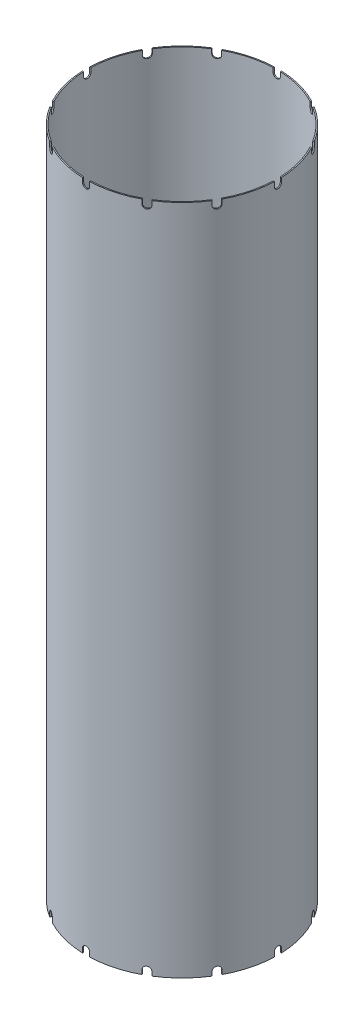
from build123d import *

# Parameters (mm, degrees)
SKETCH1_R             = 84.455
SKETCH1_R_2           = 83.439
BOSS_EXTRUDE1_DEPTH   = 591.201764
CUT_EXTRUDE1_DEPTH    = 604.145769948
CIRPATTERN1_COUNT     = 12
MIRROR1_COPY_1_DEPTH  = 604.145769948
MIRROR1_COPY_2_DEPTH  = 604.145769948
MIRROR1_COPY_3_DEPTH  = 604.145769948
MIRROR1_COPY_4_DEPTH  = 604.145769948
MIRROR1_COPY_5_DEPTH  = 604.145769948
MIRROR1_COPY_6_DEPTH  = 604.145769948
MIRROR1_COPY_7_DEPTH  = 604.145769948
MIRROR1_COPY_8_DEPTH  = 604.145769948
MIRROR1_COPY_9_DEPTH  = 604.145769948
MIRROR1_COPY_10_DEPTH = 604.145769948
MIRROR1_COPY_11_DEPTH = 604.145769948


with BuildPart() as part:
    # Sketch1 → Boss-Extrude1 (new body)
    with BuildSketch(Plane(origin=(0, 0, 0), x_dir=(1, 0, 0), z_dir=(0, 1, 0))):
        with Locations(Location((0, 0, 0), (0, 0, 270))):
            Circle(SKETCH1_R)
        with Locations(Location((0, 0, 0), (0, 0, 270))):
            Circle(SKETCH1_R_2, mode=Mode.SUBTRACT)
    extrude(amount=BOSS_EXTRUDE1_DEPTH)

    # Sketch2 → Cut-Extrude1 (cut, through all)
    with BuildSketch(Plane.XY):
        with BuildLine():
            Line((3.175, 3.81), (3.175, -68.02879514))
            ThreePointArc((3.175, -68.02879514), (0, -71.20379514), (-3.175, -68.02879514))
            Line((-3.175, -68.02879514), (-3.175, 3.81))
            ThreePointArc((-3.175, 3.81), (0, 6.985), (3.175, 3.81))
        make_face()
    cut_extrude1 = extrude(amount=-CUT_EXTRUDE1_DEPTH, mode=Mode.SUBTRACT)

    # CirPattern1: Cut-Extrude1 ×12 about axis
    cirpattern1_axis = Axis((0, 0, 0), (0, 1, 0))
    for i in range(1, CIRPATTERN1_COUNT):
        add(cut_extrude1.rotate(cirpattern1_axis, i * 360 / CIRPATTERN1_COUNT), mode=Mode.SUBTRACT)

    # Mirror1: Cut-Extrude1 across plane
    add(cut_extrude1.mirror(Plane.ZX.offset(295.600882)), mode=Mode.SUBTRACT)

    # Mirror1 copy 1 sketch → Mirror1 copy 1 (cut, through all)
    with BuildSketch(Plane(origin=(0, 591.201764, 0), x_dir=(0.8660254037844387, 0, -0.49999999999999994), z_dir=(0.49999999999999994, 0, 0.8660254037844387))):
        with BuildLine():
            Line((3.175, -3.81), (3.175, 68.02879514))
            ThreePointArc((3.175, 68.02879514), (0, 71.20379514), (-3.175, 68.02879514))
            Line((-3.175, 68.02879514), (-3.175, -3.81))
            ThreePointArc((-3.175, -3.81), (0, -6.985), (3.175, -3.81))
        make_face()
    extrude(amount=-MIRROR1_COPY_1_DEPTH, mode=Mode.SUBTRACT)

    # Mirror1 copy 2 sketch → Mirror1 copy 2 (cut, through all)
    with BuildSketch(Plane(origin=(0, 591.201764, 0), x_dir=(0.5000000000000001, 0, -0.8660254037844386), z_dir=(0.8660254037844386, 0, 0.5000000000000001))):
        with BuildLine():
            Line((3.175, -3.81), (3.175, 68.02879514))
            ThreePointArc((3.175, 68.02879514), (0, 71.20379514), (-3.175, 68.02879514))
            Line((-3.175, 68.02879514), (-3.175, -3.81))
            ThreePointArc((-3.175, -3.81), (0, -6.985), (3.175, -3.81))
        make_face()
    extrude(amount=-MIRROR1_COPY_2_DEPTH, mode=Mode.SUBTRACT)

    # Mirror1 copy 3 sketch → Mirror1 copy 3 (cut, through all)
    with BuildSketch(Plane(origin=(0, 591.201764, 0), x_dir=(0, 0, -1), z_dir=(1, 0, 0))):
        with BuildLine():
            Line((3.175, -3.81), (3.175, 68.02879514))
            ThreePointArc((3.175, 68.02879514), (0, 71.20379514), (-3.175, 68.02879514))
            Line((-3.175, 68.02879514), (-3.175, -3.81))
            ThreePointArc((-3.175, -3.81), (0, -6.985), (3.175, -3.81))
        make_face()
    extrude(amount=-MIRROR1_COPY_3_DEPTH, mode=Mode.SUBTRACT)

    # Mirror1 copy 4 sketch → Mirror1 copy 4 (cut, through all)
    with BuildSketch(Plane(origin=(0, 591.201764, 0), x_dir=(-0.4999999999999998, 0, -0.8660254037844387), z_dir=(0.8660254037844387, 0, -0.4999999999999998))):
        with BuildLine():
            Line((3.175, -3.81), (3.175, 68.02879514))
            ThreePointArc((3.175, 68.02879514), (0, 71.20379514), (-3.175, 68.02879514))
            Line((-3.175, 68.02879514), (-3.175, -3.81))
            ThreePointArc((-3.175, -3.81), (0, -6.985), (3.175, -3.81))
        make_face()
    extrude(amount=-MIRROR1_COPY_4_DEPTH, mode=Mode.SUBTRACT)

    # Mirror1 copy 5 sketch → Mirror1 copy 5 (cut, through all)
    with BuildSketch(Plane(origin=(0, 591.201764, 0), x_dir=(-0.8660254037844387, 0, -0.49999999999999994), z_dir=(0.49999999999999994, 0, -0.8660254037844387))):
        with BuildLine():
            Line((3.175, -3.81), (3.175, 68.02879514))
            ThreePointArc((3.175, 68.02879514), (0, 71.20379514), (-3.175, 68.02879514))
            Line((-3.175, 68.02879514), (-3.175, -3.81))
            ThreePointArc((-3.175, -3.81), (0, -6.985), (3.175, -3.81))
        make_face()
    extrude(amount=-MIRROR1_COPY_5_DEPTH, mode=Mode.SUBTRACT)

    # Mirror1 copy 6 sketch → Mirror1 copy 6 (cut, through all)
    with BuildSketch(Plane(origin=(0, 591.201764, 0), x_dir=(-1, 0, 0), z_dir=(0, 0, -1))):
        with BuildLine():
            Line((3.175, -3.81), (3.175, 68.02879514))
            ThreePointArc((3.175, 68.02879514), (0, 71.20379514), (-3.175, 68.02879514))
            Line((-3.175, 68.02879514), (-3.175, -3.81))
            ThreePointArc((-3.175, -3.81), (0, -6.985), (3.175, -3.81))
        make_face()
    extrude(amount=-MIRROR1_COPY_6_DEPTH, mode=Mode.SUBTRACT)

    # Mirror1 copy 7 sketch → Mirror1 copy 7 (cut, through all)
    with BuildSketch(Plane(origin=(0, 591.201764, 0), x_dir=(-0.8660254037844386, 0, 0.5000000000000001), z_dir=(-0.5000000000000001, 0, -0.8660254037844386))):
        with BuildLine():
            Line((3.175, -3.81), (3.175, 68.02879514))
            ThreePointArc((3.175, 68.02879514), (0, 71.20379514), (-3.175, 68.02879514))
            Line((-3.175, 68.02879514), (-3.175, -3.81))
            ThreePointArc((-3.175, -3.81), (0, -6.985), (3.175, -3.81))
        make_face()
    extrude(amount=-MIRROR1_COPY_7_DEPTH, mode=Mode.SUBTRACT)

    # Mirror1 copy 8 sketch → Mirror1 copy 8 (cut, through all)
    with BuildSketch(Plane(origin=(0, 591.201764, 0), x_dir=(-0.5000000000000004, 0, 0.8660254037844384), z_dir=(-0.8660254037844384, 0, -0.5000000000000004))):
        with BuildLine():
            Line((3.175, -3.81), (3.175, 68.02879514))
            ThreePointArc((3.175, 68.02879514), (0, 71.20379514), (-3.175, 68.02879514))
            Line((-3.175, 68.02879514), (-3.175, -3.81))
            ThreePointArc((-3.175, -3.81), (0, -6.985), (3.175, -3.81))
        make_face()
    extrude(amount=-MIRROR1_COPY_8_DEPTH, mode=Mode.SUBTRACT)

    # Mirror1 copy 9 sketch → Mirror1 copy 9 (cut, through all)
    with BuildSketch(Plane(origin=(0, 591.201764, 0), x_dir=(0, 0, 1), z_dir=(-1, 0, 0))):
        with BuildLine():
            Line((3.175, -3.81), (3.175, 68.02879514))
            ThreePointArc((3.175, 68.02879514), (0, 71.20379514), (-3.175, 68.02879514))
            Line((-3.175, 68.02879514), (-3.175, -3.81))
            ThreePointArc((-3.175, -3.81), (0, -6.985), (3.175, -3.81))
        make_face()
    extrude(amount=-MIRROR1_COPY_9_DEPTH, mode=Mode.SUBTRACT)

    # Mirror1 copy 10 sketch → Mirror1 copy 10 (cut, through all)
    with BuildSketch(Plane(origin=(0, 591.201764, 0), x_dir=(0.5000000000000001, 0, 0.8660254037844386), z_dir=(-0.8660254037844386, 0, 0.5000000000000001))):
        with BuildLine():
            Line((3.175, -3.81), (3.175, 68.02879514))
            ThreePointArc((3.175, 68.02879514), (0, 71.20379514), (-3.175, 68.02879514))
            Line((-3.175, 68.02879514), (-3.175, -3.81))
            ThreePointArc((-3.175, -3.81), (0, -6.985), (3.175, -3.81))
        make_face()
    extrude(amount=-MIRROR1_COPY_10_DEPTH, mode=Mode.SUBTRACT)

    # Mirror1 copy 11 sketch → Mirror1 copy 11 (cut, through all)
    with BuildSketch(Plane(origin=(0, 591.201764, 0), x_dir=(0.8660254037844384, 0, 0.5000000000000004), z_dir=(-0.5000000000000004, 0, 0.8660254037844384))):
        with BuildLine():
            Line((3.175, -3.81), (3.175, 68.02879514))
            ThreePointArc((3.175, 68.02879514), (0, 71.20379514), (-3.175, 68.02879514))
            Line((-3.175, 68.02879514), (-3.175, -3.81))
            ThreePointArc((-3.175, -3.81), (0, -6.985), (3.175, -3.81))
        make_face()
    extrude(amount=-MIRROR1_COPY_11_DEPTH, mode=Mode.SUBTRACT)


solid = part.part
